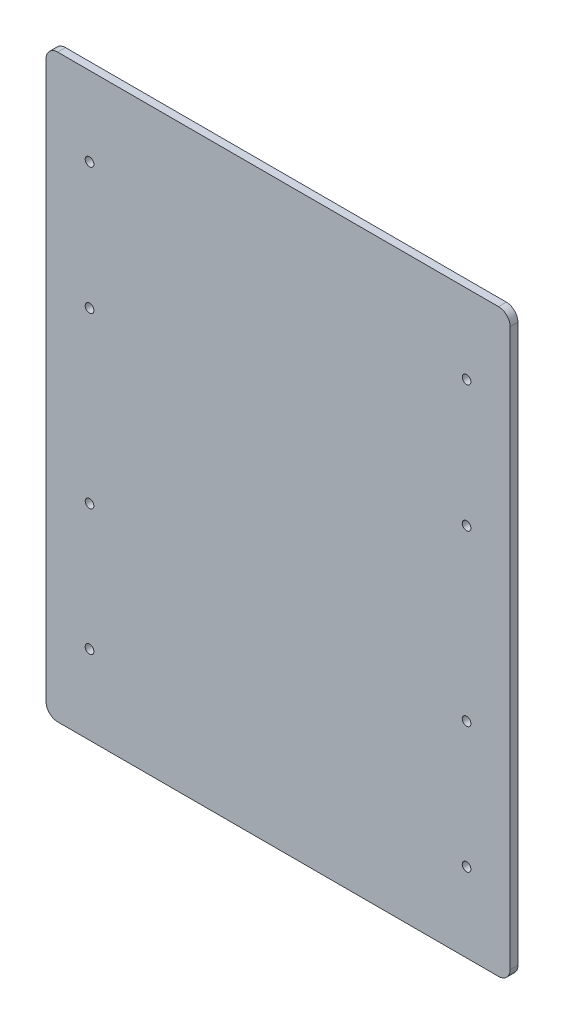
from build123d import *

# Parameters (mm, degrees)
SKETCH1_R           = 1.495
SKETCH1_R_2         = 9.688899653
BOSS_EXTRUDE1_DEPTH = 2.7


with BuildPart() as part:
    # Sketch1 → Boss-Extrude1 (new body)
    # profile 1 of 5: a face of its own
    with BuildSketch(Plane.XY):
        with BuildLine():
            Line((0, 196), (152, 196))
            ThreePointArc((152, 196), (154.828427125, 194.828427125), (156, 192))
            Line((156, 192), (156, 0))
            ThreePointArc((156, 0), (154.828427125, -2.828427125), (152, -4))
            Line((152, -4), (0, -4))
            ThreePointArc((0, -4), (-2.828427125, -2.828427125), (-4, 0))
            Line((-4, 0), (-4, 192))
            ThreePointArc((-4, 192), (-2.828427125, 194.828427125), (0, 196))
        make_face()
        with Locations(Location((140.990956122, 66.70847361, 0), (0, 0, 180))):
            Circle(SKETCH1_R, mode=Mode.SUBTRACT)
        with Locations(Location((10.990956122, 66.70847361, 0), (0, 0, 180))):
            Circle(SKETCH1_R, mode=Mode.SUBTRACT)
        with Locations(Location((10.990956122, 125.071533952, 0), (0, 0, 180))):
            Circle(SKETCH1_R, mode=Mode.SUBTRACT)
        with Locations(Location((140.990956122, 23.239588183, 0), (0, 0, 180))):
            Circle(SKETCH1_R, mode=Mode.SUBTRACT)
        with Locations(Location((10.990956122, 23.239588183, 0), (0, 0, 180))):
            Circle(SKETCH1_R, mode=Mode.SUBTRACT)
        with Locations((141, 11)):
            Circle(SKETCH1_R_2, mode=Mode.SUBTRACT)
        with Locations((11, 11)):
            Circle(SKETCH1_R_2, mode=Mode.SUBTRACT)
        with Locations((141, 181)):
            Circle(SKETCH1_R_2, mode=Mode.SUBTRACT)
        with Locations((11, 181)):
            Circle(SKETCH1_R_2, mode=Mode.SUBTRACT)
        with Locations(Location((140.990956122, 168.744033213, 0), (0, 0, 180))):
            Circle(SKETCH1_R, mode=Mode.SUBTRACT)
        with Locations(Location((10.990956122, 168.744033213, 0), (0, 0, 180))):
            Circle(SKETCH1_R, mode=Mode.SUBTRACT)
        with Locations(Location((140.990956122, 125.071533952, 0), (0, 0, 180))):
            Circle(SKETCH1_R, mode=Mode.SUBTRACT)
    # profile 2 of 5: a face of its own
    with BuildSketch(Plane.XY):
        with Locations((11, 181)):
            Circle(SKETCH1_R_2)
    # profile 3 of 5: a face of its own
    with BuildSketch(Plane.XY):
        with Locations((141, 181)):
            Circle(SKETCH1_R_2)
    # profile 4 of 5: a face of its own
    with BuildSketch(Plane.XY):
        with Locations((141, 11)):
            Circle(SKETCH1_R_2)
    # profile 5 of 5: a face of its own
    with BuildSketch(Plane.XY):
        with Locations((11, 11)):
            Circle(SKETCH1_R_2)
    extrude(amount=BOSS_EXTRUDE1_DEPTH)


solid = part.part
